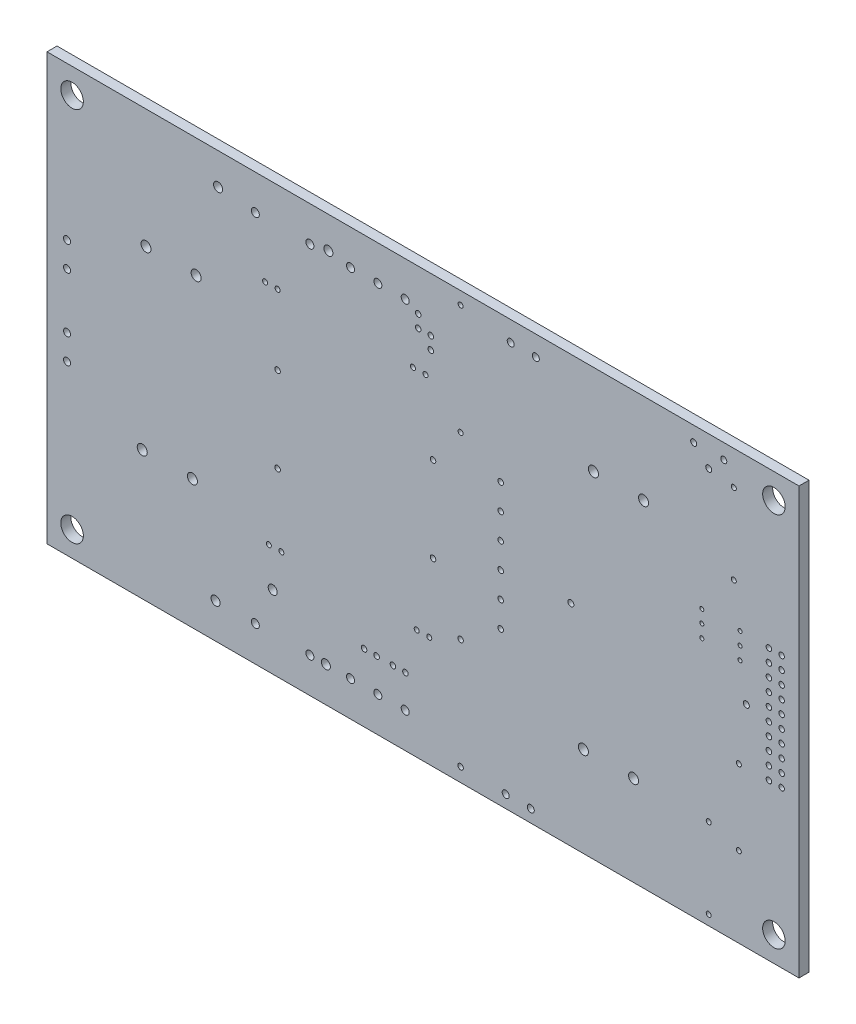
from build123d import *

# Parameters (mm, degrees)
SKETCH_1_W          = 150
SKETCH_1_H          = 85
SKETCH_1_R          = 2.25
EXTRUDE_1_DEPTH     = 2
SKETCH_2_R          = 0.55
SKETCH_2_R_2        = 0.5
SKETCH_2_R_3        = 0.8
CUT_EXTRUDE_1_DEPTH = 2
SKETCH_3_R          = 1
SKETCH_3_R_2        = 0.6
SKETCH_3_R_3        = 0.7
SKETCH_3_R_4        = 0.5
SKETCH_3_R_5        = 0.4
CUT_EXTRUDE_2_DEPTH = 10
SKETCH_4_R          = 0.9
SKETCH_4_R_2        = 0.5
SKETCH_4_R_3        = 0.55
CUT_EXTRUDE_3_DEPTH = 10


with BuildPart() as part:
    # Эскиз1 → Вытянуть1 (new body)
    with BuildSketch(Plane.XY):
        Rectangle(SKETCH_1_W, SKETCH_1_H)
        with Locations((-70, -37.5)):
            Circle(SKETCH_1_R, mode=Mode.SUBTRACT)
        with Locations(Location((70, -37.5, 0), (0, 0, 180))):
            Circle(SKETCH_1_R, mode=Mode.SUBTRACT)
        with Locations((70, 37.5)):
            Circle(SKETCH_1_R, mode=Mode.SUBTRACT)
        with Locations(Location((-70, 37.5, 0), (0, 0, 180))):
            Circle(SKETCH_1_R, mode=Mode.SUBTRACT)
    extrude(amount=EXTRUDE_1_DEPTH)

    # Эскиз2 → Вырез-Вытянуть1 (cut)
    with BuildSketch(Plane.XY.offset(2)):
        with Locations((69, 11.5)):
            Circle(SKETCH_2_R)
        with Locations((71.54, 11.5)):
            Circle(SKETCH_2_R)
        with Locations((69, 8.96)):
            Circle(SKETCH_2_R)
        with Locations((71.54, 8.96)):
            Circle(SKETCH_2_R)
        with Locations((69, 6.42)):
            Circle(SKETCH_2_R)
        with Locations((71.54, 6.42)):
            Circle(SKETCH_2_R)
        with Locations((69, 3.88)):
            Circle(SKETCH_2_R)
        with Locations((71.54, 3.88)):
            Circle(SKETCH_2_R)
        with Locations((69, 1.34)):
            Circle(SKETCH_2_R)
        with Locations((71.54, 1.34)):
            Circle(SKETCH_2_R)
        with Locations((69, -1.2)):
            Circle(SKETCH_2_R)
        with Locations((71.54, -1.2)):
            Circle(SKETCH_2_R)
        with Locations((69, -3.74)):
            Circle(SKETCH_2_R)
        with Locations((71.54, -3.74)):
            Circle(SKETCH_2_R)
        with Locations((69, -6.28)):
            Circle(SKETCH_2_R)
        with Locations((71.54, -6.28)):
            Circle(SKETCH_2_R)
        with Locations((69, -8.82)):
            Circle(SKETCH_2_R)
        with Locations((71.54, -8.82)):
            Circle(SKETCH_2_R)
        with Locations((69, -11.36)):
            Circle(SKETCH_2_R)
        with Locations((71.54, -11.36)):
            Circle(SKETCH_2_R)
        with Locations((63, -26.5)):
            Circle(SKETCH_2_R_2)
        with Locations((63, -11.5)):
            Circle(SKETCH_2_R_2)
        with Locations((-14.45, 35.5)):
            Circle(SKETCH_2_R_3)
        with Locations((-9, 35.5)):
            Circle(SKETCH_2_R_3)
        with Locations((-3.55, 35.5)):
            Circle(SKETCH_2_R_3)
        with Locations((-33.45, 35.5)):
            Circle(SKETCH_2_R_3)
        with Locations((-22.55, 35.5)):
            Circle(SKETCH_2_R_3)
        with Locations((-33.45, -35.5)):
            Circle(SKETCH_2_R_3)
        with Locations((-22.55, -35.5)):
            Circle(SKETCH_2_R_3)
        with Locations((-14.45, -35.5)):
            Circle(SKETCH_2_R_3)
        with Locations((-9, -35.5)):
            Circle(SKETCH_2_R_3)
        with Locations((-3.55, -35.5)):
            Circle(SKETCH_2_R_3)
        with Locations(Location((15.5, 13.45, 0), (0, 0, 180))):
            Circle(SKETCH_2_R)
        with Locations(Location((15.5, 8.37, 0), (0, 0, 180))):
            Circle(SKETCH_2_R)
        with Locations(Location((15.5, -1.79, 0), (0, 0, 180))):
            Circle(SKETCH_2_R)
        with Locations(Location((15.5, 3.29, 0), (0, 0, 180))):
            Circle(SKETCH_2_R)
        with Locations(Location((15.5, -6.87, 0), (0, 0, 180))):
            Circle(SKETCH_2_R)
        with Locations((15.5, -11.95)):
            Circle(SKETCH_2_R)
    extrude(amount=-CUT_EXTRUDE_1_DEPTH, mode=Mode.SUBTRACT)

    # Эскиз3 → Вырез-Вытянуть2 (cut)
    with BuildSketch(Plane.XY.offset(2)):
        with Locations((-55.25, 18.75)):
            Circle(SKETCH_3_R)
        with Locations((-45.25, 18.75)):
            Circle(SKETCH_3_R)
        with Locations((-56, -16.75)):
            Circle(SKETCH_3_R)
        with Locations((-46, -16.75)):
            Circle(SKETCH_3_R)
        with Locations((54, 39.5)):
            Circle(SKETCH_3_R_2)
        with Locations((60, 39.5)):
            Circle(SKETCH_3_R_2)
        with Locations((16.5, -40)):
            Circle(SKETCH_3_R_3)
        with Locations((21.5, -40)):
            Circle(SKETCH_3_R_3)
        with Locations((-71, 7)):
            Circle(SKETCH_3_R_3)
        with Locations((-71, 12)):
            Circle(SKETCH_3_R_3)
        with Locations((-71, -9)):
            Circle(SKETCH_3_R_3)
        with Locations((-71, -4)):
            Circle(SKETCH_3_R_3)
        with Locations((57, -40.5)):
            Circle(SKETCH_3_R_4)
        with Locations((57, -24.5)):
            Circle(SKETCH_3_R_4)
        with Locations((34, 24.5)):
            Circle(SKETCH_3_R)
        with Locations((44, 24.5)):
            Circle(SKETCH_3_R)
        with Locations((32, -24.5)):
            Circle(SKETCH_3_R)
        with Locations((42, -24.5)):
            Circle(SKETCH_3_R)
        with Locations((57, 36.5)):
            Circle(SKETCH_3_R_2)
        with Locations((17.5, 38.5)):
            Circle(SKETCH_3_R_3)
        with Locations((62, 19.75)):
            Circle(SKETCH_3_R_4)
        with Locations((62, 35.75)):
            Circle(SKETCH_3_R_4)
        with Locations((63.24, 11.58)):
            Circle(SKETCH_3_R_5)
        with Locations((63.24, 6.5)):
            Circle(SKETCH_3_R_5)
        with Locations((55.62, 9.04)):
            Circle(SKETCH_3_R_5)
        with Locations((63.24, 9.04)):
            Circle(SKETCH_3_R_5)
        with Locations((55.62, 6.5)):
            Circle(SKETCH_3_R_5)
        with Locations((55.62, 11.58)):
            Circle(SKETCH_3_R_5)
        with Locations((22.5, 38.5)):
            Circle(SKETCH_3_R_3)
        with Locations((64.5, -0.5)):
            Circle(SKETCH_3_R_2)
        with Locations((29.5, -0.5)):
            Circle(SKETCH_3_R_2)
    extrude(amount=-CUT_EXTRUDE_2_DEPTH, mode=Mode.SUBTRACT)

    # Эскиз4 → Вырез-Вытянуть3 (cut)
    with BuildSketch(Plane.XY.offset(2)):
        with Locations((-41.37, -35.5)):
            Circle(SKETCH_4_R)
        with Locations((-40.87, 36.2)):
            Circle(SKETCH_4_R)
        with Locations((-31.5, 24.5)):
            Circle(SKETCH_4_R_2)
        with Locations((-19.37, -35.5)):
            Circle(SKETCH_4_R)
        with Locations((-6, -29)):
            Circle(SKETCH_4_R_3)
        with Locations((-18.87, 36.2)):
            Circle(SKETCH_4_R)
        with Locations((0.5, 24.5)):
            Circle(SKETCH_4_R_2)
        with Locations((-29, 24.5)):
            Circle(SKETCH_4_R_2)
        with Locations((-0.95, 31.75)):
            Circle(SKETCH_4_R_3)
        with Locations((1.55, 31.75)):
            Circle(SKETCH_4_R_3)
        with Locations((-2, 24.5)):
            Circle(SKETCH_4_R_2)
        with Locations((7.5, -39.75)):
            Circle(SKETCH_4_R_3)
        with Locations((7.5, -17.75)):
            Circle(SKETCH_4_R_3)
        with Locations((-29.979016563, -27.918029446)):
            Circle(SKETCH_4_R)
        with Locations((-11.75, -29)):
            Circle(SKETCH_4_R_3)
        with Locations((7.5, 18)):
            Circle(SKETCH_4_R_2)
        with Locations((7.5, 40)):
            Circle(SKETCH_4_R_2)
        with Locations((-9.25, -29)):
            Circle(SKETCH_4_R_3)
        with Locations((-3.5, -29)):
            Circle(SKETCH_4_R_3)
        with Locations((-29, 10.5)):
            Circle(SKETCH_4_R_3)
        with Locations((2, 10.5)):
            Circle(SKETCH_4_R_3)
        with Locations((-0.95, 34.25)):
            Circle(SKETCH_4_R_3)
        with Locations((1.55, 29.25)):
            Circle(SKETCH_4_R_3)
        with Locations((-29, -6.5)):
            Circle(SKETCH_4_R_3)
        with Locations((2, -6.5)):
            Circle(SKETCH_4_R_3)
        with Locations((-30.75, -20.5)):
            Circle(SKETCH_4_R_2)
        with Locations((1.25, -20.5)):
            Circle(SKETCH_4_R_2)
        with Locations((-28.25, -20.5)):
            Circle(SKETCH_4_R_2)
        with Locations((-1.25, -20.5)):
            Circle(SKETCH_4_R_2)
    extrude(amount=-CUT_EXTRUDE_3_DEPTH, mode=Mode.SUBTRACT)


solid = part.part
